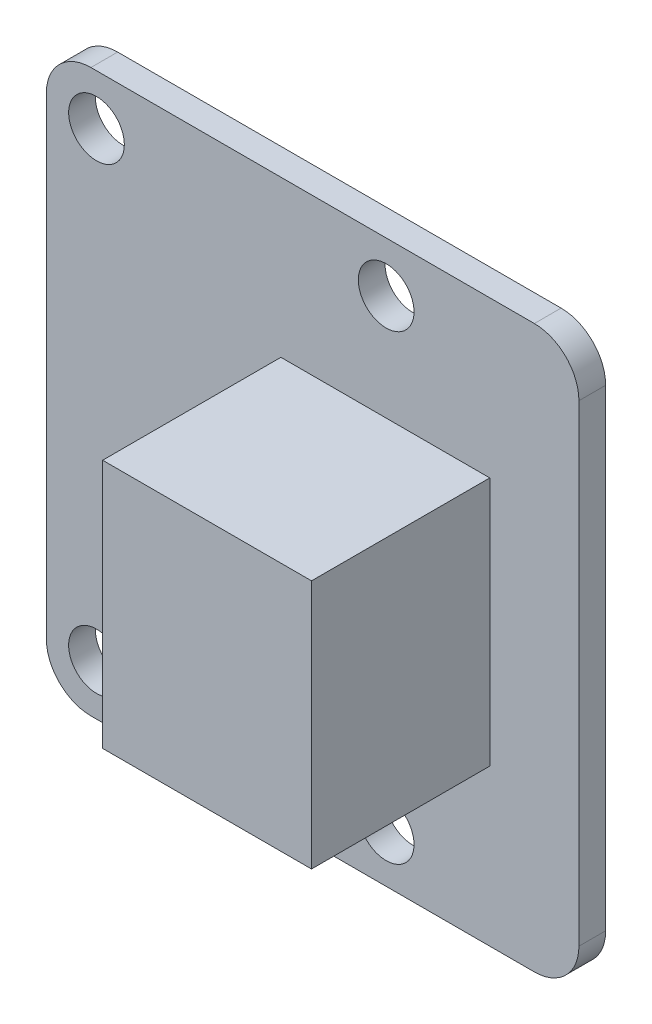
from build123d import *

# Parameters (mm, degrees)
CROQUIS1_W              = 25.2
CROQUIS1_H              = 23.9
SALIENTE_EXTRUIR1_DEPTH = 1.2
CROQUIS2_R              = 1.25
CORTAR_EXTRUIR1_DEPTH   = 1.2
REDONDEO1_R             = 2
CROQUIS3_W              = 9.37393079
CROQUIS3_H              = 11.2
SALIENTE_EXTRUIR2_DEPTH = 8


with BuildPart() as part:
    # Croquis1 → Saliente-Extruir1 (new body)
    with BuildSketch(Plane(origin=(0, 0, 0), x_dir=(0, 1, 0), z_dir=(0, 0, 1))):
        Rectangle(CROQUIS1_W, CROQUIS1_H)
    extrude(amount=SALIENTE_EXTRUIR1_DEPTH)

    # Croquis2 → Cortar-Extruir1 (cut)
    with BuildSketch(Plane.XY.offset(1.2)):
        with Locations((-9.7, -10.35)):
            Circle(CROQUIS2_R)
        with Locations((3.3, -10.35)):
            Circle(CROQUIS2_R)
        with Locations((3.3, 10.35)):
            Circle(CROQUIS2_R)
        with Locations((-9.7, 10.35)):
            Circle(CROQUIS2_R)
    extrude(amount=-CORTAR_EXTRUIR1_DEPTH, mode=Mode.SUBTRACT)

    # Redondeo1
    redondeo1_edges = [part.edges().sort_by_distance(p)[0] for p in [
        (11.95, 12.6, 0.6),
        (11.95, -12.6, 0.6),
        (-11.95, -12.6, 0.6),
        (-11.95, 12.6, 0.6),
    ]]
    fillet(redondeo1_edges, radius=REDONDEO1_R)

    # Croquis3 → Saliente-Extruir2 (add)
    with BuildSketch(Plane.XY.offset(1.2)):
        with Locations((3.263034605, 0)):
            Rectangle(CROQUIS3_W, CROQUIS3_H)
    extrude(amount=SALIENTE_EXTRUIR2_DEPTH)


solid = part.part
